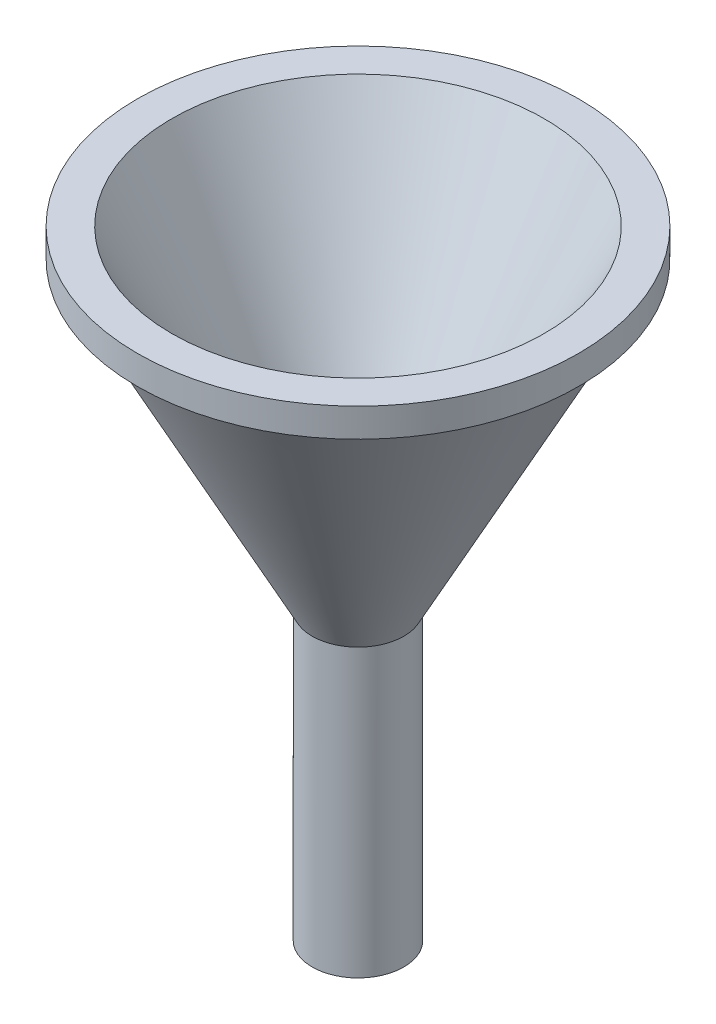
from build123d import *

# Parameters (mm, degrees)
SKETCH2_R           = 38.5
SKETCH2_R_2         = 32.5
BOSS_EXTRUDE1_DEPTH = 5


with BuildPart() as part:
    # Sketch1 → Revolve1 (revolve)
    with BuildSketch(Plane.XY, mode=Mode.PRIVATE) as revolve1_sk:
        Polygon((2, 0), (2, 50), (32.5, 108), (38.5, 108), (8, 50), (8, 0), align=None)
    revolve(revolve1_sk.sketch.rotate(Axis((0, 0, 0), (0, 1, 0)), 90), axis=Axis((0, 0, 0), (0, 1, 0)))

    # Sketch2 → Boss-Extrude1 (add)
    with BuildSketch(Plane(origin=(0, 108, 0), x_dir=(1, 0, 0), z_dir=(0, 1, 0))):
        with Locations(Location((0, 0, 0), (0, 0, 270))):
            Circle(SKETCH2_R)
        Circle(SKETCH2_R_2, mode=Mode.SUBTRACT)
    extrude(amount=-BOSS_EXTRUDE1_DEPTH)


solid = part.part
